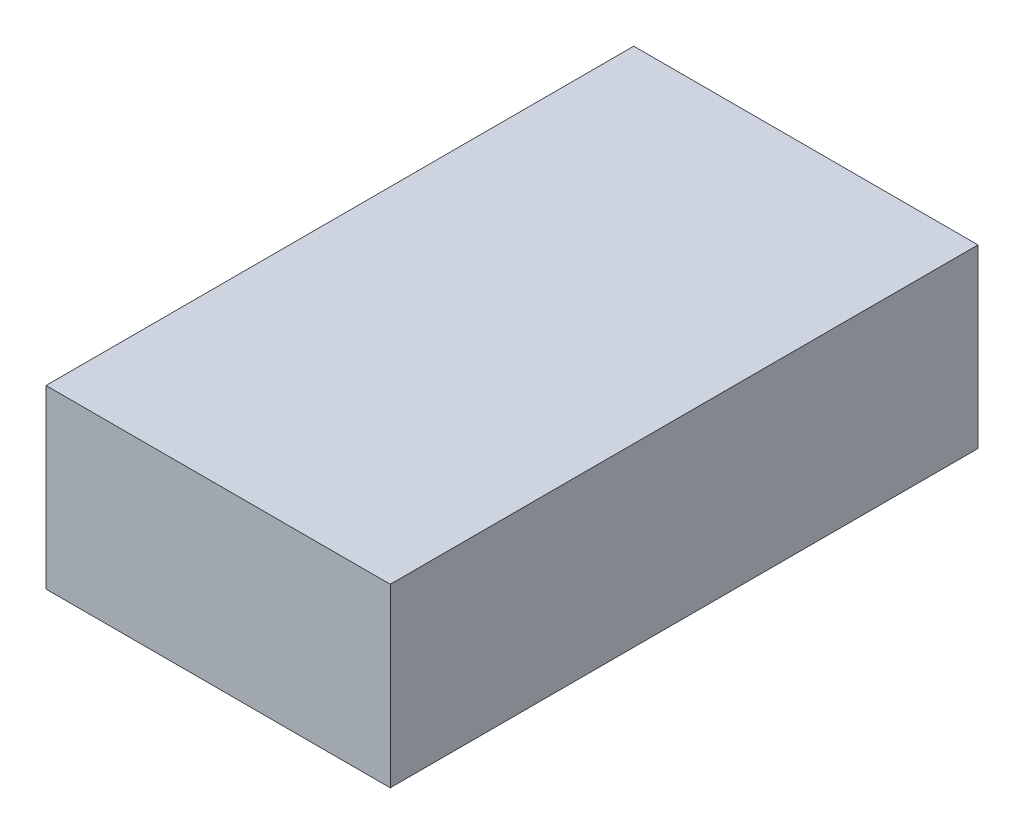
from build123d import *

# Parameters (mm, degrees)
SKETCH1_W           = 41
SKETCH1_H           = 21
BOSS_EXTRUDE1_DEPTH = 70


with BuildPart() as part:
    # Sketch1 → Boss-Extrude1 (new body)
    with BuildSketch(Plane.XY):
        Rectangle(SKETCH1_W, SKETCH1_H)
    extrude(amount=BOSS_EXTRUDE1_DEPTH)


solid = part.part
